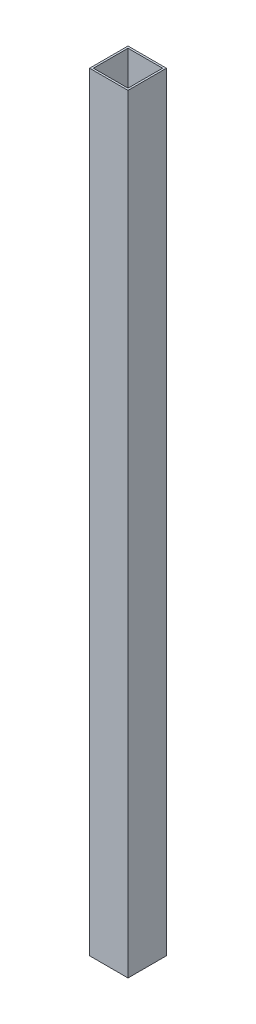
from build123d import *

# Parameters (mm, degrees)
SKETCH1_W           = 25.4
SKETCH1_H           = 25.4
BOSS_EXTRUDE1_DEPTH = 508


with BuildPart() as part:
    # Sketch1 → Boss-Extrude1 (new body)
    with BuildSketch(Plane(origin=(0, 0, 0), x_dir=(1, 0, 0), z_dir=(0, 1, 0))):
        with Locations((12.7, 12.7)):
            Rectangle(SKETCH1_W, SKETCH1_H)
        Polygon((1.27, 12.361459156), (1.27, 24.13), (12.7, 24.13), (24.13, 24.13), (24.13, 12.7), (24.13, 1.27), (12.7, 1.27), (1.27, 1.27), align=None, mode=Mode.SUBTRACT)
    extrude(amount=BOSS_EXTRUDE1_DEPTH)


solid = part.part
